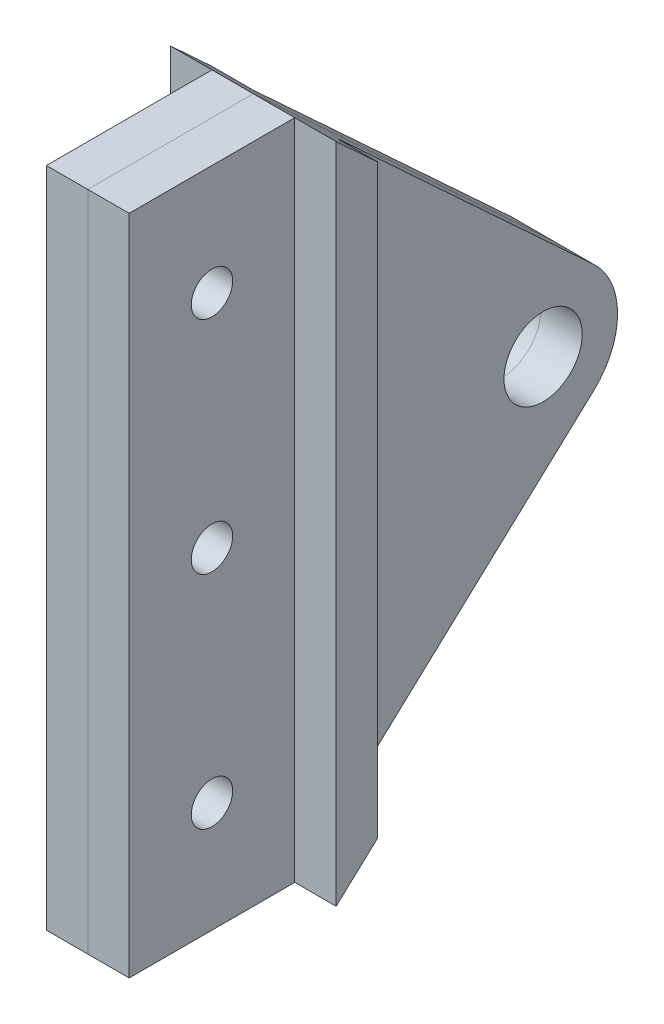
from build123d import *

# Parameters (mm, degrees)
SKETCH1_R           = 3.175
BOSS_EXTRUDE1_DEPTH = 6.35
BOSS_EXTRUDE2_DEPTH = 12.7


with BuildPart() as part:
    # Sketch1 → Boss-Extrude1 (new body)
    with BuildSketch(Plane(origin=(0, 0, 0), x_dir=(0, 0, -1), z_dir=(1, 0, 0))):
        with BuildLine():
            Line((1356.277423264, 45.696435511), (1402.137630748, 88.104529898))
            ThreePointArc((1402.137630748, 88.104529898), (1405.807423264, 96.496435511), (1402.137630748, 104.888341124))
            Line((1402.137630748, 104.888341124), (1356.277423264, 147.296435511))
            Line((1356.277423264, 147.296435511), (1330.877423264, 147.296435511))
            Line((1330.877423264, 147.296435511), (1330.877423264, 45.696435511))
            Line((1330.877423264, 45.696435511), (1356.277423264, 45.696435511))
        make_face()
        with Locations((1343.577423264, 130.363102178)):
            Circle(SKETCH1_R, mode=Mode.SUBTRACT)
        with Locations((1343.577423264, 62.629768844)):
            Circle(SKETCH1_R, mode=Mode.SUBTRACT)
        with Locations((1343.577423264, 96.496435511)):
            Circle(SKETCH1_R, mode=Mode.SUBTRACT)
        with BuildLine():
            add(Edge.make_bspline(
                [(1388.377423264, 96.496435511), (1388.377423264, 86.104526373), (1397.377423264, 91.300480942), (1406.377423264, 96.496435511), (1397.377423264, 101.69239008), (1388.377423264, 106.888344649), (1388.377423264, 96.496435511)],
                knots=[0, 0, 0, 2.094395102, 2.094395102, 4.188790205, 4.188790205, 6.283185307, 6.283185307, 6.283185307], degree=2, weights=[1, 0.5, 1, 0.5, 1, 0.5, 1]))
        make_face(mode=Mode.SUBTRACT)
    extrude(amount=BOSS_EXTRUDE1_DEPTH)

    # Sketch1<4> → Boss-Extrude2 (add)
    with BuildSketch(Plane(origin=(0, 0, 0), x_dir=(0, 0, -1), z_dir=(1, 0, 0))):
        Polygon((1362.627423264, 51.568441203), (1362.627423264, 141.42442982), (1356.277423264, 147.296435511), (1356.277423264, 45.696435511), align=None)
    extrude(amount=BOSS_EXTRUDE2_DEPTH)


with BuildPart() as body_2:
    # Mirror1: mirrored copy
    add(part.part.mirror(Plane(origin=(0, 0, 0), x_dir=(0, 0, 1), z_dir=(1, 0, 0))))


solid = Compound([part.part, body_2.part])
